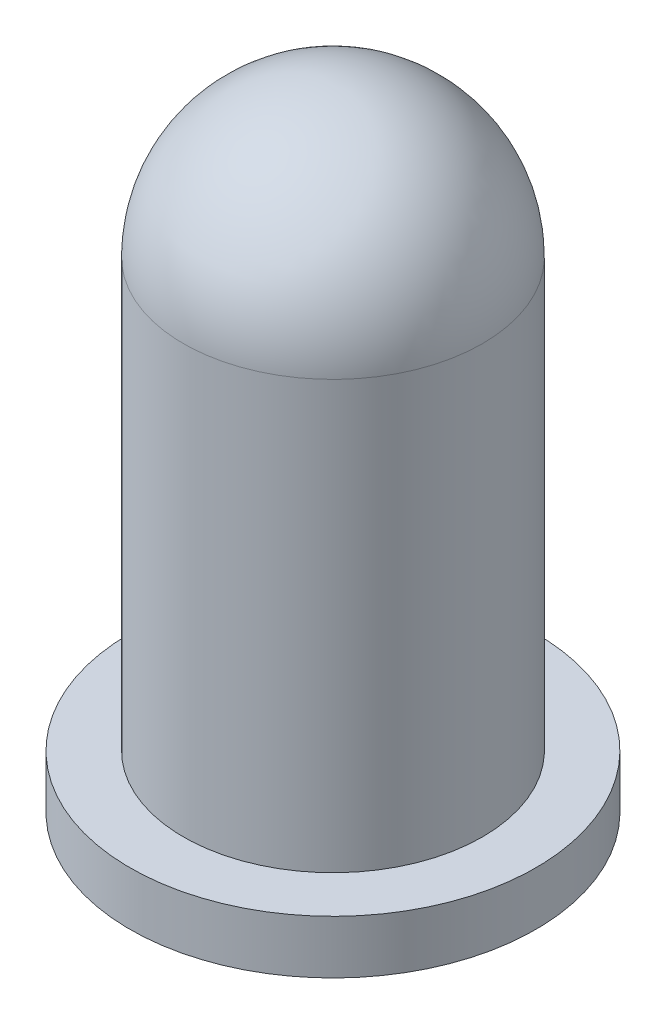
from build123d import *


with BuildPart() as part:
    # Sketch1 → Revolve2 (revolve)
    with BuildSketch(Plane.XY, mode=Mode.PRIVATE) as revolve2_sk:
        with BuildLine():
            Line((1.4, 0.5), (1.4, 4.5))
            ThreePointArc((1.4, 4.5), (0.989949494, 5.489949494), (0, 5.9))
            Line((0, 5.9), (0, 0))
            Line((0, 0), (1.4, 0))
            Line((1.4, 0), (1.9, 0))
            Line((1.9, 0), (1.9, 0.5))
            Line((1.9, 0.5), (1.4, 0.5))
        make_face()
    revolve(revolve2_sk.sketch.rotate(Axis((0, 5.9, 0), (0, -1, 0)), 180), axis=Axis((0, 5.9, 0), (0, -1, 0)))


solid = part.part
